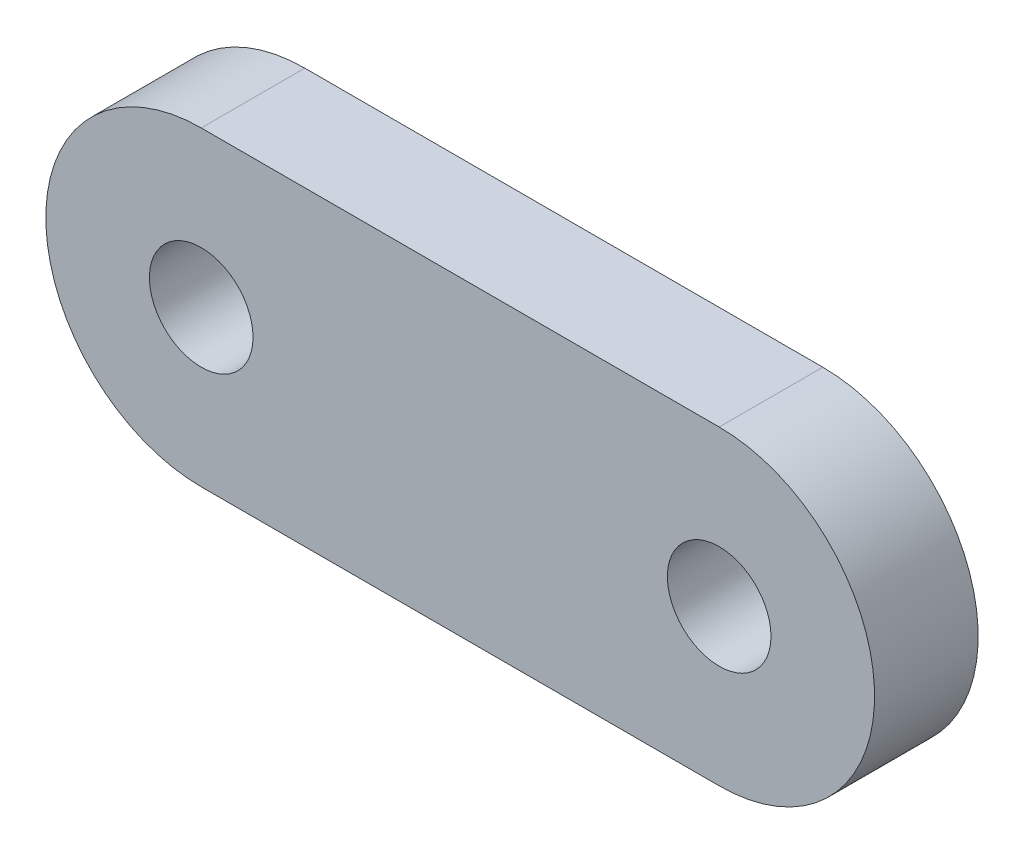
from build123d import *

# Parameters (mm, degrees)
SKETCH1_R           = 1
BOSS_EXTRUDE1_DEPTH = 2


with BuildPart() as part:
    # Sketch1 → Boss-Extrude1 (new body)
    with BuildSketch(Plane.XY):
        with BuildLine():
            Line((0, 3), (10, 3))
            ThreePointArc((10, 3), (13, 0), (10, -3))
            Line((10, -3), (0, -3))
            ThreePointArc((0, -3), (-3, 0), (0, 3))
        make_face()
        with Locations((10, 0)):
            Circle(SKETCH1_R, mode=Mode.SUBTRACT)
        Circle(SKETCH1_R, mode=Mode.SUBTRACT)
    extrude(amount=BOSS_EXTRUDE1_DEPTH)


solid = part.part
